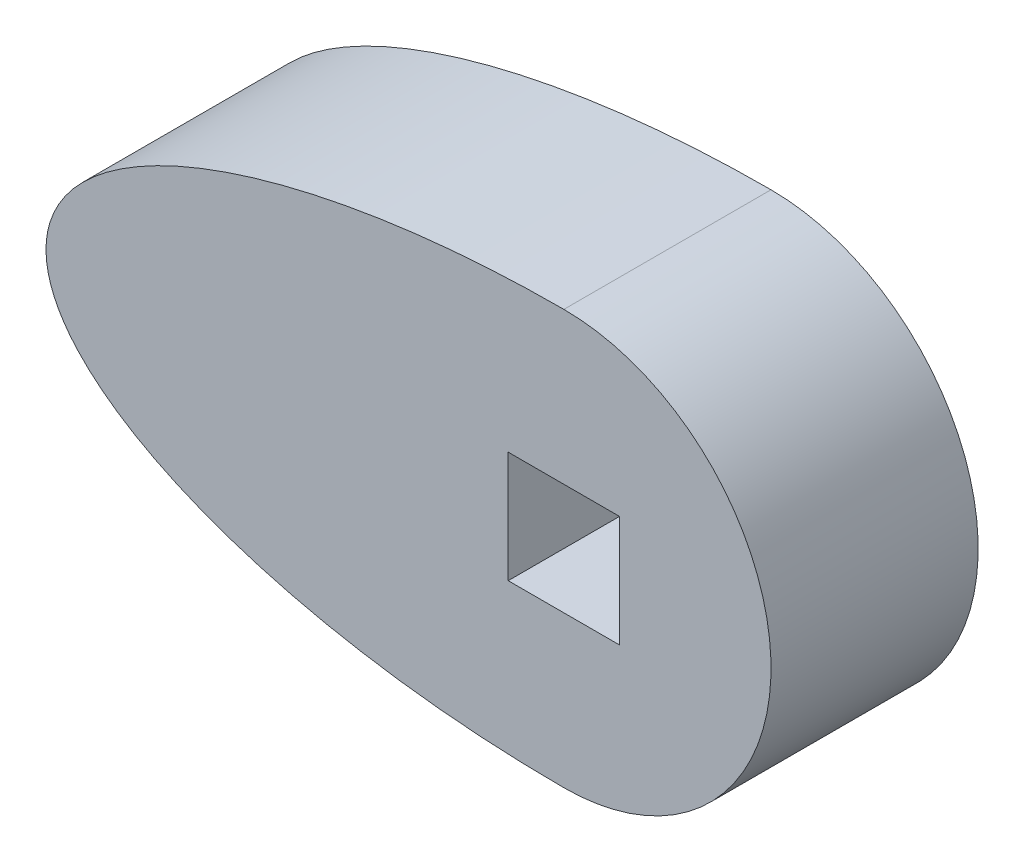
from build123d import *

# Parameters (mm, degrees)
BOSS_EXTRUDE5_DEPTH = 10
SKETCH3_W           = 5.374011538
SKETCH3_H           = 5.374011538
CUT_EXTRUDE2_DEPTH  = 29.722813389


with BuildPart() as part:
    # Sketch5 → Boss-Extrude5 (new body)
    with BuildSketch(Plane.XY):
        with BuildLine():
            Line((0, 0), (-25, 0))
            add(Edge.make_bspline(
                [(0, 10), (-25, 10), (-25, 0)],
                knots=[4.71238898, 4.71238898, 4.71238898, 6.283185307, 6.283185307, 6.283185307], degree=2, weights=[1, 0.707106781, 1]))
            ThreePointArc((0, 10), (7.071067812, 7.071067812), (10, 0))
            Line((10, 0), (0, 0))
        make_face()
    extrude(amount=-BOSS_EXTRUDE5_DEPTH)

    # Mirror2: part across plane


with BuildPart() as part_1:
    add(part.part)
    add(part.part.mirror(Plane(origin=(0, 0, -10), x_dir=(0, 0, 1), z_dir=(0, -1, 0))))

    # Sketch3 → Cut-Extrude2 (cut, through all)
    with BuildSketch(Plane.XY):
        Rectangle(SKETCH3_W, SKETCH3_H)
    extrude(amount=-CUT_EXTRUDE2_DEPTH, mode=Mode.SUBTRACT)


solid = part_1.part
